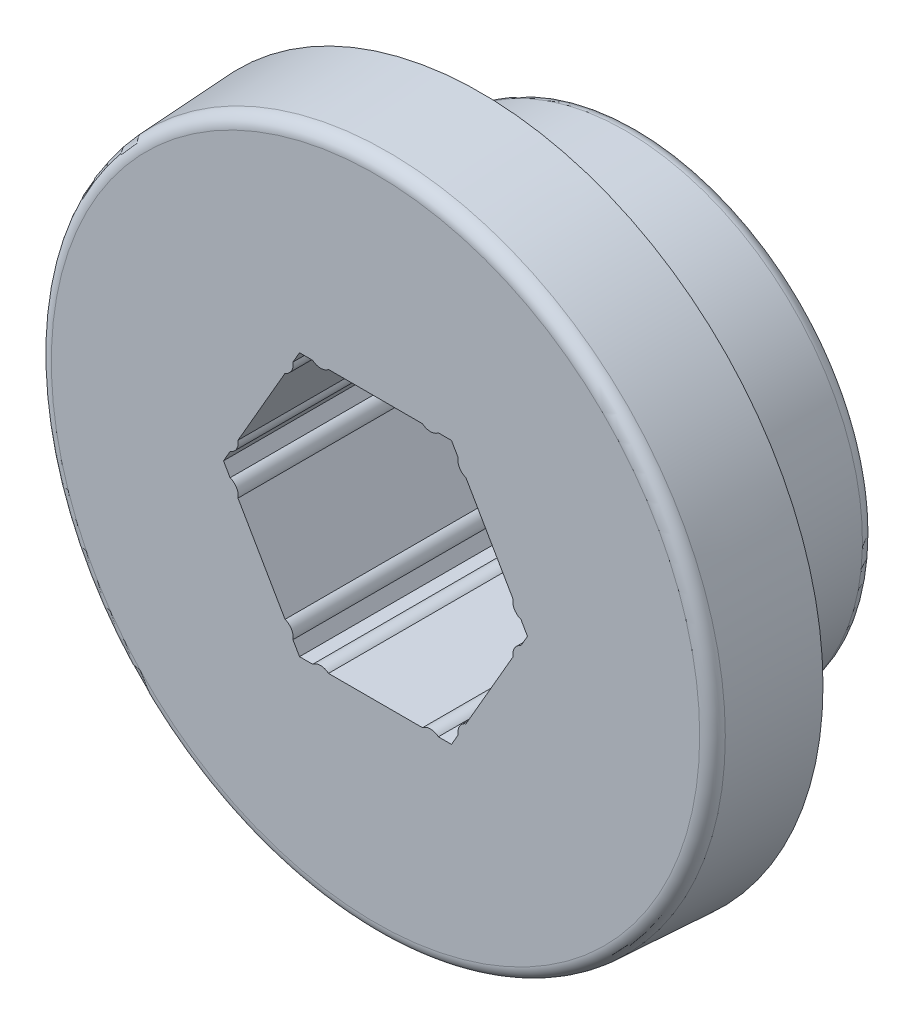
from build123d import *

# Parameters (mm, degrees)
SKETCH2_R           = 4.5
BOSS_EXTRUDE1_DEPTH = 3
CUT_EXTRUDE1_DEPTH  = 11.464224768
FILLET1_R           = 0.25


with BuildPart() as part:
    # Sketch1 → Revolve1 (revolve)
    with BuildSketch(Plane(origin=(0, 0, 0), x_dir=(1, 0, 0), z_dir=(0, 1, 0))):
        Polygon((6.5, 0), (0, 0), (0, -2), (6.395184442, -2), align=None)
    revolve(axis=Axis((0, 0, 0), (0, 0, 1)))

    # Sketch2 → Boss-Extrude1 (add)
    with BuildSketch(Plane(origin=(0, 0, 0), x_dir=(-1, 0, 0), z_dir=(0, 0, -1))):
        with Locations(Location((0, 0, 0), (0, 0, 90))):
            Circle(SKETCH2_R)
    extrude(amount=BOSS_EXTRUDE1_DEPTH)

    # Sketch3 → Cut-Extrude1 (cut, through all)
    with BuildSketch(Plane.XY.offset(2)):
        with BuildLine():
            Line((1.568375673, 2.283493649), (1.443375673, 2.5))
            Line((1.443375673, 2.5), (1.193375673, 2.5))
            ThreePointArc((1.193375673, 2.5), (1.043375673, 2.445), (0.893375673, 2.5))
            Line((0.893375673, 2.5), (-0.893375673, 2.5))
            ThreePointArc((-0.893375673, 2.5), (-1.043375673, 2.445), (-1.193375673, 2.5))
            Line((-1.193375673, 2.5), (-1.443375673, 2.5))
            Line((-1.443375673, 2.5), (-1.568375673, 2.283493649))
            ThreePointArc((-1.568375673, 2.283493649), (-1.595744276, 2.126089838), (-1.718375673, 2.023686028))
            Line((-1.718375673, 2.023686028), (-2.611751346, 0.476313972))
            ThreePointArc((-2.611751346, 0.476313972), (-2.639119949, 0.318910162), (-2.761751346, 0.216506351))
            Line((-2.761751346, 0.216506351), (-2.886751346, 0))
            Line((-2.886751346, 0), (-2.761751346, -0.216506351))
            ThreePointArc((-2.761751346, -0.216506351), (-2.639119949, -0.318910162), (-2.611751346, -0.476313972))
            Line((-2.611751346, -0.476313972), (-1.718375673, -2.023686028))
            ThreePointArc((-1.718375673, -2.023686028), (-1.595744276, -2.126089838), (-1.568375673, -2.283493649))
            Line((-1.568375673, -2.283493649), (-1.443375673, -2.5))
            Line((-1.443375673, -2.5), (-1.193375673, -2.5))
            ThreePointArc((-1.193375673, -2.5), (-1.043375673, -2.445), (-0.893375673, -2.5))
            Line((-0.893375673, -2.5), (0.893375673, -2.5))
            ThreePointArc((0.893375673, -2.5), (1.043375673, -2.445), (1.193375673, -2.5))
            Line((1.193375673, -2.5), (1.443375673, -2.5))
            Line((1.443375673, -2.5), (1.568375673, -2.283493649))
            ThreePointArc((1.568375673, -2.283493649), (1.595744276, -2.126089838), (1.718375673, -2.023686028))
            Line((1.718375673, -2.023686028), (2.611751346, -0.476313972))
            ThreePointArc((2.611751346, -0.476313972), (2.639119949, -0.318910162), (2.761751346, -0.216506351))
            Line((2.761751346, -0.216506351), (2.886751346, 0))
            Line((2.886751346, 0), (2.761751346, 0.216506351))
            ThreePointArc((2.761751346, 0.216506351), (2.639119949, 0.318910162), (2.611751346, 0.476313972))
            Line((2.611751346, 0.476313972), (1.718375673, 2.023686028))
            ThreePointArc((1.718375673, 2.023686028), (1.595744276, 2.126089838), (1.568375673, 2.283493649))
        make_face()
    extrude(amount=-CUT_EXTRUDE1_DEPTH, mode=Mode.SUBTRACT)

    # Fillet1
    fillet1_edges = [part.edges().sort_by_distance(p)[0] for p in [
        (-6.395184442, 0, 2),
        (0, -4.5, -3),
    ]]
    fillet(fillet1_edges, radius=FILLET1_R)


solid = part.part
